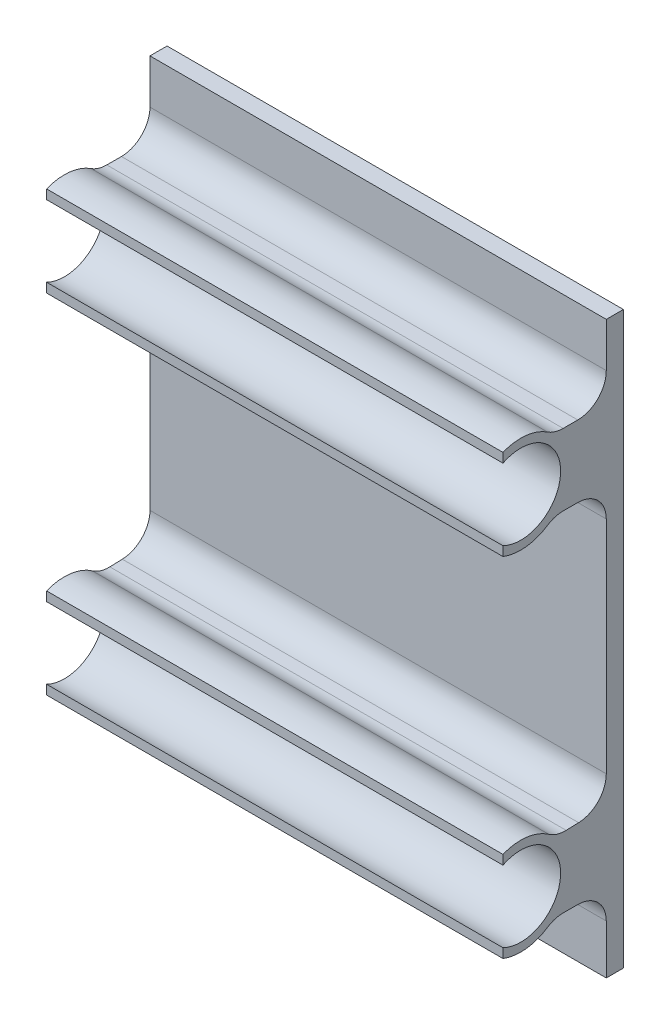
from build123d import *

# Parameters (mm, degrees)
SKETCH1_W           = 80
SKETCH1_H           = 100
BOSS_EXTRUDE1_DEPTH = 3
BOSS_EXTRUDE3_DEPTH = 80
FILLET1_R           = 5
FILLET2_R           = 5


with BuildPart() as part:
    # Sketch1 → Boss-Extrude1 (new body)
    with BuildSketch(Plane.XY):
        with Locations((18.436653688, 8.767310739)):
            Rectangle(SKETCH1_W, SKETCH1_H)
    extrude(amount=BOSS_EXTRUDE1_DEPTH)

    # Sketch3 → Boss-Extrude3 (add)
    with BuildSketch(Plane(origin=(58.436653688, 0, 0), x_dir=(0, 0, -1), z_dir=(1, 0, 0))):
        with BuildLine():
            Line((-1.837245717, 45.99131425), (-12.257916981, 45.99131425))
            ThreePointArc((-12.257916981, 45.99131425), (-16.452700501, 48.082041529), (-21.117934797, 47.631554803))
            Line((-21.117934797, 47.631554803), (-21.117934797, 45.99131425))
            ThreePointArc((-21.117934797, 45.99131425), (-11, 39.72405946), (-21.117934797, 33.45680467))
            Line((-21.117934797, 33.45680467), (-21.117934797, 31.816564117))
            ThreePointArc((-21.117934797, 31.816564117), (-16.452700501, 31.366077392), (-12.257916981, 33.45680467))
            Line((-12.257916981, 33.45680467), (-1.837245717, 33.45680467))
            Line((-1.837245717, 33.45680467), (-1.837245717, 45.99131425))
        make_face()
        with BuildLine():
            Line((-21.117934797, -13.401976374), (-21.117934797, -15.042216928))
            ThreePointArc((-21.117934797, -15.042216928), (-11, -21.309471718), (-21.117934797, -27.576726507))
            Line((-21.117934797, -27.576726507), (-21.117934797, -29.216967061))
            ThreePointArc((-21.117934797, -29.216967061), (-16.452700501, -29.667453786), (-12.257916981, -27.576726507))
            Line((-12.257916981, -27.576726507), (-1.837245717, -27.576726507))
            Line((-1.837245717, -27.576726507), (-1.837245717, -15.042216928))
            Line((-1.837245717, -15.042216928), (-11.936738174, -15.352387193))
            ThreePointArc((-11.936738174, -15.352387193), (-16.233714798, -12.995012229), (-21.117934797, -13.401976374))
        make_face()
    extrude(amount=-BOSS_EXTRUDE3_DEPTH)

    # Fillet1
    fillet1_edges = [part.edges().sort_by_distance(p)[0] for p in [
        (18.436653688, 45.99131425, 12.257916981),
        (18.436653688, 33.45680467, 12.257916981),
        (18.436653688, -15.352387193, 11.936738174),
        (18.436653688, -27.576726507, 12.257916981),
    ]]
    fillet(fillet1_edges, radius=FILLET1_R)

    # Fillet2
    fillet2_edges = [part.edges().sort_by_distance(p)[0] for p in [
        (18.436653688, 33.45680467, 3),
        (18.436653688, 45.99131425, 3),
        (18.436653688, -27.576726507, 3),
        (18.436653688, -15.077926822, 3),
    ]]
    fillet(fillet2_edges, radius=FILLET2_R)


solid = part.part
